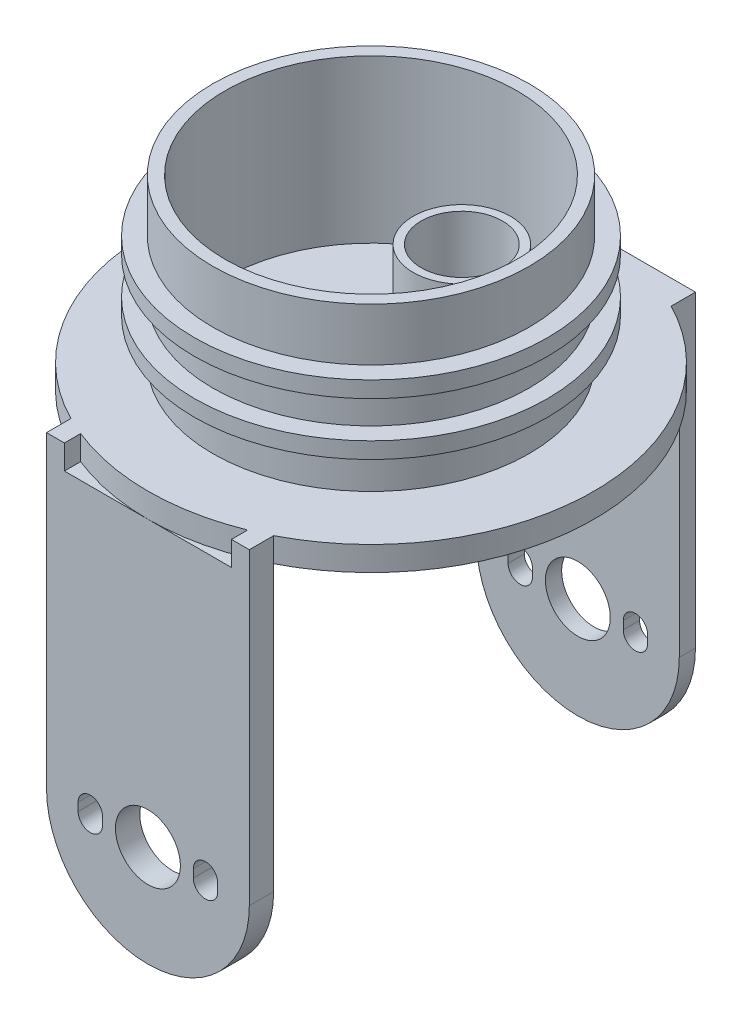
from build123d import *

# Parameters (mm, degrees)
SKETCH_1_R               = 19.5
SKETCH_1_R_2             = 18
EXTRUDE_1_DEPTH          = 20
SKETCH_3_R               = 27.5
EXTRUDE_2_DEPTH          = 3
SKETCH_10_R              = 6
SKETCH_10_R_2            = 5
EXTRUDE_6_DEPTH          = 10
CUT_EXTRUDE_4_DEPTH      = 19
CUT_EXTRUDE_4_DEPTH_BACK = 10
SKETCH_11_R              = 5.007506695
EXTRUDE_START            = 2
SKETCH_25_R              = 21.75
SKETCH_25_R_2            = 19.5
EXTRUDE_12_DEPTH         = 2
EXTRUDE_START_2          = -1
SKETCH_26_R              = 21.75
SKETCH_26_R_2            = 19.5
EXTRUDE_13_DEPTH         = 2
SKETCH_27_W              = 25
SKETCH_27_H              = 51
SKETCH_27_R              = 5.007506695
EXTRUDE_14_DEPTH         = 3
SKETCH_28_R              = 4
EXTRUDE_17_DEPTH         = 2
EXTRUDE_START_3          = -53
SKETCH_28_15_R           = 4
EXTRUDE_19_DEPTH         = 53
SKETCH_32_W              = 2.204369859
SKETCH_32_H              = 3
EXTRUDE_20_DEPTH         = 2
CUT_EXTRUDE_START        = -50
SKETCH_28_18_R           = 4
CUT_EXTRUDE_8_DEPTH      = 50


with BuildPart() as part:
    # 草圖1 → 填料-伸長1 (new body)
    with BuildSketch(Plane(origin=(0, 0, 0), x_dir=(1, 0, 0), z_dir=(0, 1, 0))):
        Circle(SKETCH_1_R)
        Circle(SKETCH_1_R_2, mode=Mode.SUBTRACT)
    extrude(amount=EXTRUDE_1_DEPTH)

    # 草圖3 → 填料-伸長2 (add)
    with BuildSketch(Plane.XZ):
        Circle(SKETCH_3_R)
    extrude(amount=EXTRUDE_2_DEPTH)

    # 草圖10 → 填料-伸長6 (add)
    with BuildSketch(Plane(origin=(0, -3, 0), x_dir=(-1, 0, 0), z_dir=(0, -1, 0))):
        with Locations((0, 11.196036894)):
            Circle(SKETCH_10_R)
        with Locations((0, 11.196036894)):
            Circle(SKETCH_10_R_2, mode=Mode.SUBTRACT)
    extrude(amount=-EXTRUDE_6_DEPTH)

    # 草圖11 → 除料-伸長4 (cut, two sides: drawn at the far end of the back side and taken through both)
    with BuildSketch(Plane(origin=(0, -3, 0), x_dir=(-1, 0, 0), z_dir=(0, -1, 0)).offset(-CUT_EXTRUDE_4_DEPTH_BACK)):
        with Locations((0, 11.196036894)):
            Circle(SKETCH_11_R)
    extrude(amount=CUT_EXTRUDE_4_DEPTH + CUT_EXTRUDE_4_DEPTH_BACK, mode=Mode.SUBTRACT)

    # 草圖25 → 填料-伸長12 (add)
    with BuildSketch(Plane(origin=(0, 7, 0), x_dir=(-1, 0, 0), z_dir=(0, -1, 0)).offset(EXTRUDE_START)):
        Circle(SKETCH_25_R)
        Circle(SKETCH_25_R_2, mode=Mode.SUBTRACT)
    extrude(amount=-EXTRUDE_12_DEPTH)

    # 草圖26 → 填料-伸長13 (add)
    with BuildSketch(Plane(origin=(0, 10.5, 0), x_dir=(-1, 0, 0), z_dir=(0, -1, 0)).offset(EXTRUDE_START_2)):
        Circle(SKETCH_26_R)
        Circle(SKETCH_26_R_2, mode=Mode.SUBTRACT)
    extrude(amount=-EXTRUDE_13_DEPTH)

    # 草圖27 → 填料-伸長14 (add)
    with BuildSketch(Plane.XZ.offset(3)):
        Rectangle(SKETCH_27_W, SKETCH_27_H)
        with Locations((0, -11.196036894)):
            Circle(SKETCH_27_R, mode=Mode.SUBTRACT)
    extrude(amount=-EXTRUDE_14_DEPTH)

    # 草圖28 → 填料-伸長17 (add)
    with BuildSketch(Plane(origin=(0, 0, -25.5), x_dir=(-1, 0, 0), z_dir=(0, 0, -1))):
        with BuildLine():
            Line((12.5, 0), (-12.5, 0))
            Line((-12.5, 0), (-12.5, -38))
            ThreePointArc((-12.5, -38), (0, -50.5), (12.5, -38))
            Line((12.5, -38), (12.5, 0))
        make_face()
        with BuildLine():
            Line((8.6, -37.5), (8.6, -38.5))
            ThreePointArc((8.6, -38.5), (7.1, -40), (5.6, -38.5))
            Line((5.6, -38.5), (5.6, -37.5))
            ThreePointArc((5.6, -37.5), (7.1, -36), (8.6, -37.5))
        make_face(mode=Mode.SUBTRACT)
        with Locations((0, -38)):
            Circle(SKETCH_28_R, mode=Mode.SUBTRACT)
        with BuildLine():
            Line((-5.6, -37.5), (-5.6, -38.5))
            ThreePointArc((-5.6, -38.5), (-7.1, -40), (-8.6, -38.5))
            Line((-8.6, -38.5), (-8.6, -37.5))
            ThreePointArc((-8.6, -37.5), (-7.1, -36), (-5.6, -37.5))
        make_face(mode=Mode.SUBTRACT)
    extrude(amount=EXTRUDE_17_DEPTH)

    # 草圖28<15> → 填料-伸長19 (add)
    with BuildSketch(Plane(origin=(0, 0, -25.5), x_dir=(-1, 0, 0), z_dir=(0, 0, -1)).offset(EXTRUDE_START_3)):
        with BuildLine():
            Line((12.5, -38), (12.5, -3))
            Line((12.5, -3), (-12.5, -3))
            Line((-12.5, -3), (-12.5, -38))
            ThreePointArc((-12.5, -38), (0, -50.5), (12.5, -38))
        make_face()
        with BuildLine():
            Line((8.6, -37.5), (8.6, -38.5))
            ThreePointArc((8.6, -38.5), (7.1, -40), (5.6, -38.5))
            Line((5.6, -38.5), (5.6, -37.5))
            ThreePointArc((5.6, -37.5), (7.1, -36), (8.6, -37.5))
        make_face(mode=Mode.SUBTRACT)
        with Locations((0, -38)):
            Circle(SKETCH_28_15_R, mode=Mode.SUBTRACT)
        with BuildLine():
            Line((-5.6, -37.5), (-5.6, -38.5))
            ThreePointArc((-5.6, -38.5), (-7.1, -40), (-8.6, -38.5))
            Line((-8.6, -38.5), (-8.6, -37.5))
            ThreePointArc((-8.6, -37.5), (-7.1, -36), (-5.6, -37.5))
        make_face(mode=Mode.SUBTRACT)
    extrude(amount=EXTRUDE_19_DEPTH)

    # 草圖32 → 填料-伸長20 (add)
    with BuildSketch(Plane.XY.offset(25.5)):
        with Locations((11.397815071, -1.5)):
            Rectangle(SKETCH_32_W, SKETCH_32_H)
        with Locations((-11.397815071, -1.5)):
            Rectangle(SKETCH_32_W, SKETCH_32_H)
    extrude(amount=EXTRUDE_20_DEPTH)

    # 草圖28<18> → 除料-伸長8 (cut)
    with BuildSketch(Plane(origin=(0, 0, -25.5), x_dir=(-1, 0, 0), z_dir=(0, 0, -1)).offset(CUT_EXTRUDE_START)):
        with BuildLine():
            Line((12.5, -38), (12.5, -3))
            Line((12.5, -3), (-12.5, -3))
            Line((-12.5, -3), (-12.5, -38))
            ThreePointArc((-12.5, -38), (0, -50.5), (12.5, -38))
        make_face()
        with BuildLine():
            Line((8.6, -37.5), (8.6, -38.5))
            ThreePointArc((8.6, -38.5), (7.1, -40), (5.6, -38.5))
            Line((5.6, -38.5), (5.6, -37.5))
            ThreePointArc((5.6, -37.5), (7.1, -36), (8.6, -37.5))
        make_face(mode=Mode.SUBTRACT)
        with Locations((0, -38)):
            Circle(SKETCH_28_18_R, mode=Mode.SUBTRACT)
        with BuildLine():
            Line((-5.6, -37.5), (-5.6, -38.5))
            ThreePointArc((-5.6, -38.5), (-7.1, -40), (-8.6, -38.5))
            Line((-8.6, -38.5), (-8.6, -37.5))
            ThreePointArc((-8.6, -37.5), (-7.1, -36), (-5.6, -37.5))
        make_face(mode=Mode.SUBTRACT)
    extrude(amount=CUT_EXTRUDE_8_DEPTH, mode=Mode.SUBTRACT)


solid = part.part
